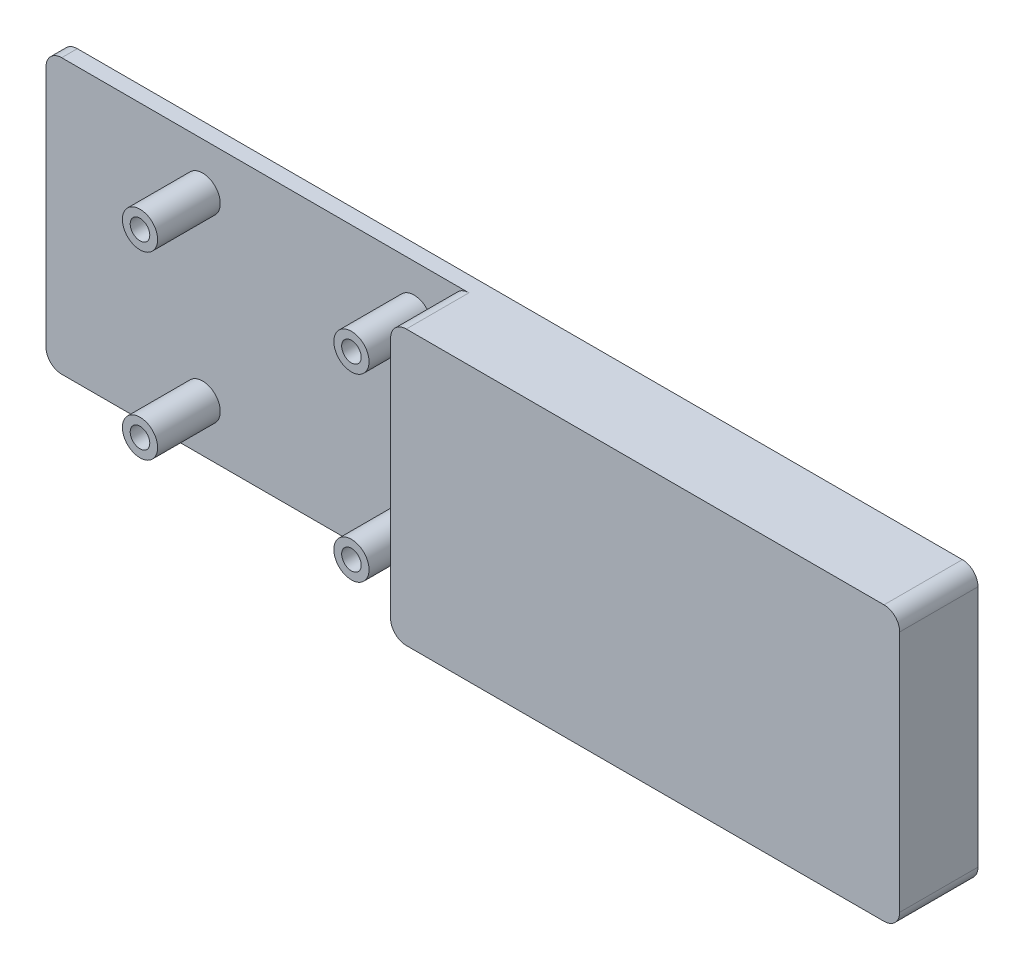
from build123d import *

# Parameters (mm, degrees)
SKETCH1_R             = 2.25
SKETCH1_R_2           = 1.25
BOSS_EXTRUDE1_DEPTH   = 10
BOSS_EXTRUDE1_2_DEPTH = 10
BOSS_EXTRUDE1_3_DEPTH = 10
BOSS_EXTRUDE1_4_DEPTH = 10
SKETCH1_3_W           = 117
SKETCH1_3_H           = 35
BOSS_EXTRUDE2_DEPTH   = 2
SKETCH1_4_W           = 65
SKETCH1_4_H           = 35
BOSS_EXTRUDE3_DEPTH   = 10
FILLET1_R             = 2


with BuildPart() as part:
    # Sketch1 → Boss-Extrude1 (new body)
    with BuildSketch(Plane.XY):
        with Locations((-38.5, -11.5)):
            Circle(SKETCH1_R)
        with Locations((-38.5, -11.5)):
            Circle(SKETCH1_R_2, mode=Mode.SUBTRACT)
    extrude(amount=BOSS_EXTRUDE1_DEPTH)



with BuildPart() as body_2:
    # Sketch1 → Boss-Extrude1 2 (new body)
    with BuildSketch(Plane.XY):
        with Locations((-11.5, -11.5)):
            Circle(SKETCH1_R)
        with Locations((-11.5, -11.5)):
            Circle(SKETCH1_R_2, mode=Mode.SUBTRACT)
    extrude(amount=BOSS_EXTRUDE1_2_DEPTH)


with BuildPart() as body_3:
    # Sketch1 → Boss-Extrude1 3 (new body)
    with BuildSketch(Plane.XY):
        with Locations((-11.5, 11.5)):
            Circle(SKETCH1_R)
        with Locations((-11.5, 11.5)):
            Circle(SKETCH1_R_2, mode=Mode.SUBTRACT)
    extrude(amount=BOSS_EXTRUDE1_3_DEPTH)


with BuildPart() as body_4:
    # Sketch1 → Boss-Extrude1 4 (new body)
    with BuildSketch(Plane.XY):
        with Locations((-38.5, 11.5)):
            Circle(SKETCH1_R)
        with Locations((-38.5, 11.5)):
            Circle(SKETCH1_R_2, mode=Mode.SUBTRACT)
    extrude(amount=BOSS_EXTRUDE1_4_DEPTH)


with BuildPart() as part_1:
    add(part.part)

    add(body_2.part)  # Boss-Extrude2 merges body 2

    add(body_3.part)  # Boss-Extrude2 merges body 3

    add(body_4.part)  # Boss-Extrude2 merges body 4
    # Sketch1<3> → Boss-Extrude2 (add)
    with BuildSketch(Plane.XY):
        Rectangle(SKETCH1_3_W, SKETCH1_3_H)
    extrude(amount=BOSS_EXTRUDE2_DEPTH)

    # Sketch1<4> → Boss-Extrude3 (add)
    with BuildSketch(Plane.XY):
        with Locations((26, 0)):
            Rectangle(SKETCH1_4_W, SKETCH1_4_H)
    extrude(amount=BOSS_EXTRUDE3_DEPTH)

    # Fillet1
    fillet1_edges = [part_1.edges().sort_by_distance(p)[0] for p in [
        (-58.5, 17.5, 1),
        (58.5, 17.5, 5),
        (58.5, -17.5, 5),
        (-58.5, -17.5, 1),
        (-6.5, -17.5, 6),
        (-6.5, 17.5, 6),
    ]]
    fillet(fillet1_edges, radius=FILLET1_R)


solid = part_1.part
